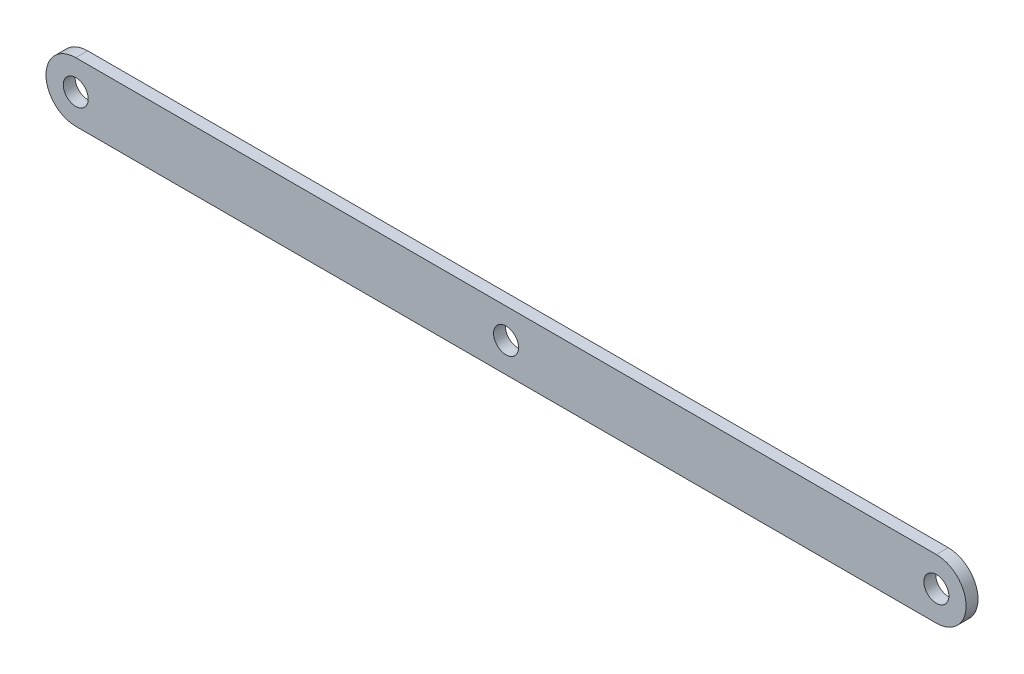
from build123d import *

# Parameters (mm, degrees)
SKIZZE2_R                       = 2.1
AUFSATZ_LINEAR_AUSTRAGEN1_DEPTH = 2


with BuildPart() as part:
    # Skizze2 → Aufsatz-Linear austragen1 (new body)
    with BuildSketch(Plane.XY):
        with BuildLine():
            Line((-72.34, 5), (72.34, 5))
            ThreePointArc((72.34, 5), (77.34, 0), (72.34, -5))
            Line((72.34, -5), (-72.34, -5))
            ThreePointArc((-72.34, -5), (-77.34, 0), (-72.34, 5))
        make_face()
        with Locations((-72.34, 0)):
            Circle(SKIZZE2_R, mode=Mode.SUBTRACT)
        with Locations((72.34, 0)):
            Circle(SKIZZE2_R, mode=Mode.SUBTRACT)
        Circle(SKIZZE2_R, mode=Mode.SUBTRACT)
    extrude(amount=AUFSATZ_LINEAR_AUSTRAGEN1_DEPTH)


solid = part.part
